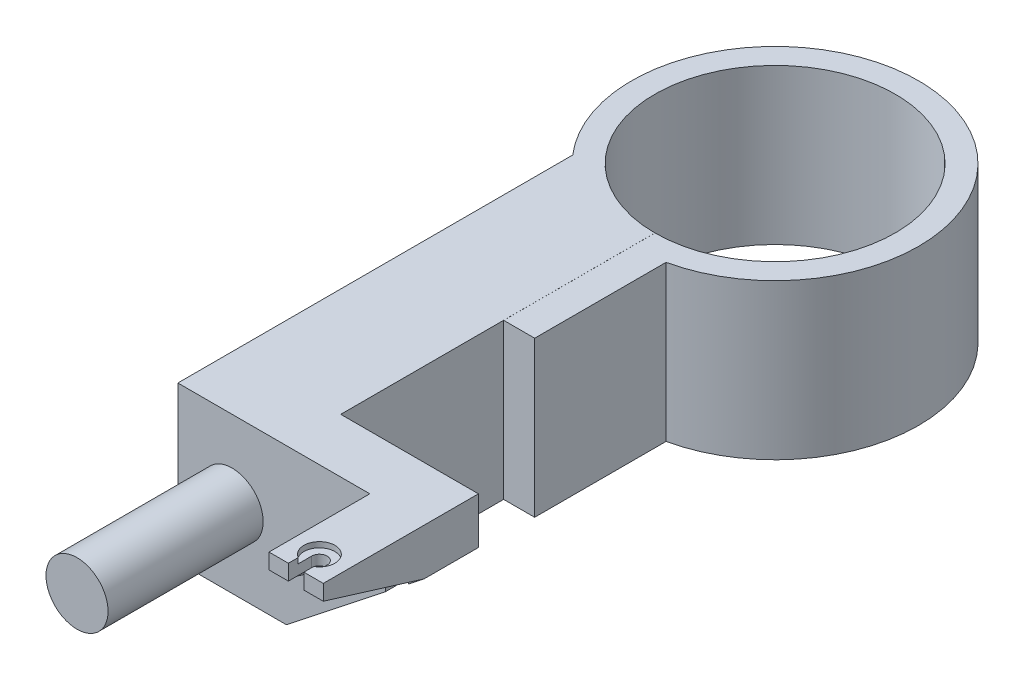
from build123d import *

# Parameters (mm, degrees)
BOSS_EXTRUDE1_DEPTH = 20
SKETCH2_R           = 4
BOSS_EXTRUDE2_DEPTH = 20
BOSS_EXTRUDE3_DEPTH = 2
BOSS_EXTRUDE4_DEPTH = 18
CUT_EXTRUDE1_DEPTH  = 22
BOSS_EXTRUDE5_DEPTH = 2
SKETCH8_R           = 2
CUT_EXTRUDE3_DEPTH  = 0.7
CUT_EXTRUDE2_REACH  = 94.752
SKETCH6_W           = 19.696996452
SKETCH6_H           = 13.58493718
CUT_EXTRUDE4_REACH  = 94.752
BOSS_EXTRUDE6_START = -2
BOSS_EXTRUDE6_DEPTH = 2
BOSS_EXTRUDE7_DEPTH = 2
BOSS_EXTRUDE8_START = -20
BOSS_EXTRUDE8_DEPTH = 20


with BuildPart() as part:
    # Sketch1 → Boss-Extrude1 (new body)
    with BuildSketch(Plane(origin=(0, 0, 0), x_dir=(1, 0, 0), z_dir=(0, 1, 0))):
        with BuildLine():
            Line((0, -15.5), (0, -63))
            Line((0, -63), (-14, -63))
            Line((-14, -63), (-14, -12.093386622))
            ThreePointArc((-14, -12.093386622), (-16.822271733, 7.698127938), (0, 18.5))
            Line((0, 18.5), (0, 15.5))
            ThreePointArc((0, 15.5), (-15.5, 0), (0, -15.5))
        make_face()
        with BuildLine():
            Line((-11, -60), (-11, -14.874474781))
            ThreePointArc((-11, -14.874474781), (-7.201195596, -17.04091494), (-3, -18.255136264))
            Line((-3, -18.255136264), (-3, -60))
            Line((-3, -60), (-11, -60))
        make_face(mode=Mode.SUBTRACT)
    extrude(amount=BOSS_EXTRUDE1_DEPTH)

    # Sketch2 → Boss-Extrude2 (add)
    with BuildSketch(Plane.XY.offset(63)):
        with Locations(Location((-7, 10, 0), (0, 0, 180))):
            Circle(SKETCH2_R)
    extrude(amount=BOSS_EXTRUDE2_DEPTH)

    # Sketch3 → Boss-Extrude3 (add)
    with BuildSketch(Plane(origin=(0, 20, 0), x_dir=(1, 0, 0), z_dir=(0, 1, 0))):
        with BuildLine():
            Line((0, -63), (10.749394376, -63))
            Line((10.749394376, -63), (10.749394376, -76))
            Line((10.749394376, -76), (13.249394376, -76))
            Line((13.249394376, -76), (13.249394376, -73))
            ThreePointArc((13.249394376, -73), (14.249394376, -72), (15.249394376, -73))
            Line((15.249394376, -73), (15.249394376, -76))
            Line((15.249394376, -76), (17.749394376, -76))
            Line((17.749394376, -76), (17.749394376, -56))
            Line((17.749394376, -56), (0, -56))
            Line((0, -56), (0, -63))
        make_face()
        Polygon((2, -58), (15.749394376, -58), (15.749394376, -69), (12.749394376, -69), (12.749394376, -61), (2, -61), align=None, mode=Mode.SUBTRACT)
    extrude(amount=-BOSS_EXTRUDE3_DEPTH)

    # Sketch4 → Boss-Extrude4 (add)
    with BuildSketch(Plane.XZ.offset(-18)):
        Polygon((15.749394376, 69), (15.749394376, 58), (2, 58), (2, 61), (12.749394376, 61), (12.749394376, 69), (12.749394376, 76), (10.749394376, 76), (10.749394376, 66), (10.749394376, 63), (0, 63), (0, 56), (17.749394376, 56), (17.749394376, 66), (17.749394376, 76), (15.749394376, 76), align=None)
    extrude(amount=BOSS_EXTRUDE4_DEPTH)

    # Sketch5 → Cut-Extrude1 (cut)
    with BuildSketch(Plane(origin=(0, 0, 56), x_dir=(-1, 0, 0), z_dir=(0, 0, -1))):
        Polygon((0, 0), (-17.749394376, 14), (-17.749394376, -1.554529852), (0, -1.554529852), align=None)
    extrude(amount=-CUT_EXTRUDE1_DEPTH, mode=Mode.SUBTRACT)

    # Sketch7 → Boss-Extrude5 (add)
    with BuildSketch(Plane(origin=(0, 20, 0), x_dir=(1, 0, 0), z_dir=(0, 1, 0))):
        Polygon((2, -61), (12.749394376, -61), (12.749394376, -69), (15.749394376, -69), (15.749394376, -58), (2, -58), align=None)
    extrude(amount=-BOSS_EXTRUDE5_DEPTH)

    # Sketch8 → Cut-Extrude3 (cut)
    with BuildSketch(Plane(origin=(0, 20, 0), x_dir=(1, 0, 0), z_dir=(0, 1, 0))):
        with Locations((14.249394376, -73)):
            Circle(SKETCH8_R)
    extrude(amount=-CUT_EXTRUDE3_DEPTH, mode=Mode.SUBTRACT)

    # Cut-Extrude2: up to this face of the body (flat: up to its plane)
    cut_extrude2_end = Plane(part.part.faces().sort_by_distance((10.749394376, 14.239342427, 69.5))[0])
    # Sketch6 → Cut-Extrude2 (cut, up to the picked face)
    with BuildSketch(Plane(origin=(17.749394376, 0, 0), x_dir=(0, 0, -1), z_dir=(1, 0, 0)), mode=Mode.PRIVATE) as cut_extrude2_sk1:
        with Locations((-72.848498226, 7.20753141)):
            Rectangle(SKETCH6_W, SKETCH6_H)
    cut_extrude2_tool1 = split(extrude(cut_extrude2_sk1.sketch, amount=-CUT_EXTRUDE2_REACH, mode=Mode.PRIVATE), bisect_by=cut_extrude2_end, keep=Keep.BOTH, mode=Mode.PRIVATE)
    add(cut_extrude2_tool1.solids().sort_by(Axis((17.749394, 7.207531, 72.848498), (-1, 0, 0)))[0], mode=Mode.SUBTRACT)

    # Cut-Extrude4: up to this face of the body (flat: up to its plane)
    cut_extrude4_end = Plane(part.part.faces().sort_by_distance((10.749394376, 17, 69.5))[0])
    # Sketch10 → Cut-Extrude4 (cut, up to the picked face)
    with BuildSketch(Plane(origin=(17.749394376, 0, 0), x_dir=(0, 0, -1), z_dir=(1, 0, 0)), mode=Mode.PRIVATE) as cut_extrude4_sk1:
        Polygon((-63, 14), (-76, 18), (-76, 12.216867542), (-63, 12.216867542), align=None)
    cut_extrude4_tool1 = split(extrude(cut_extrude4_sk1.sketch, amount=-CUT_EXTRUDE4_REACH, mode=Mode.PRIVATE), bisect_by=cut_extrude4_end, keep=Keep.BOTH, mode=Mode.PRIVATE)
    add(cut_extrude4_tool1.solids().sort_by(Axis((17.749394, 14.284655, 70.645435), (-1, 0, 0)))[0], mode=Mode.SUBTRACT)

    # Sketch11 → Boss-Extrude6 (add)
    with BuildSketch(Plane(origin=(0, 20, 0), x_dir=(1, 0, 0), z_dir=(0, 1, 0)).offset(BOSS_EXTRUDE6_START)):
        with BuildLine():
            Line((-11, -14.874474781), (-11, -60))
            Line((-11, -60), (-3, -60))
            Line((-3, -60), (-3, -18.255136264))
            ThreePointArc((-3, -18.255136264), (-7.201195596, -17.04091494), (-11, -14.874474781))
        make_face()
    extrude(amount=BOSS_EXTRUDE6_DEPTH)

    # Sketch12 → Boss-Extrude7 (add)
    with BuildSketch(Plane.XZ):
        with BuildLine():
            Line((-3, 60), (-3, 18.255136264))
            ThreePointArc((-3, 18.255136264), (-7.201195596, 17.04091494), (-11, 14.874474781))
            Line((-11, 14.874474781), (-11, 60))
            Line((-11, 60), (-3, 60))
        make_face()
    extrude(amount=-BOSS_EXTRUDE7_DEPTH)

    # Sketch13 → Boss-Extrude8 (add)
    with BuildSketch(Plane(origin=(0, 20, 0), x_dir=(1, 0, 0), z_dir=(0, 1, 0)).offset(BOSS_EXTRUDE8_START)):
        with BuildLine():
            Line((0, 15.5), (0, 18.5))
            ThreePointArc((0, 18.5), (18.390272559, 2.011933204), (4, -18.062391868))
            Line((4, -18.062391868), (4, -35))
            Line((4, -35), (0.01, -35))
            Line((0.01, -35), (0.01, -15.499996774))
            ThreePointArc((0.01, -15.499996774), (15.499999194, 0.005), (0, 15.5))
        make_face()
    extrude(amount=BOSS_EXTRUDE8_DEPTH)


solid = part.part
